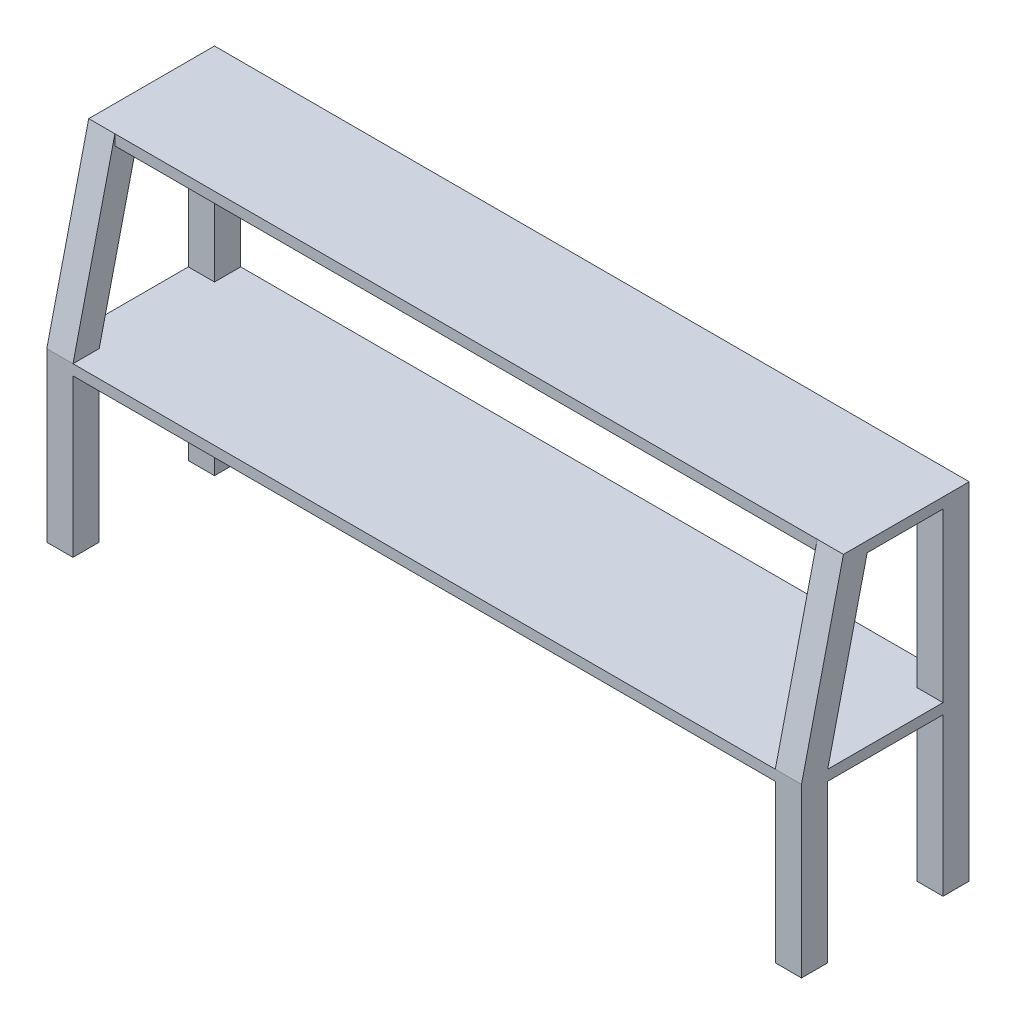
from build123d import *

# Parameters (mm, degrees)
SKETCH1_W           = 914.4
SKETCH1_H           = 203.2
BOSS_EXTRUDE1_DEPTH = 12.7
SKETCH2_W           = 914.4
SKETCH2_H           = 152.4
BOSS_EXTRUDE2_DEPTH = 12.7
SKETCH3_W           = 31.75
SKETCH3_H           = 419.1
BOSS_EXTRUDE3_DEPTH = 31.75
BOSS_EXTRUDE4_START = -914.4
SKETCH3_2_W         = 31.75
SKETCH3_2_H         = 419.1
BOSS_EXTRUDE4_DEPTH = 31.75


with BuildPart() as part:
    # Sketch1 → Boss-Extrude1 (new body)
    with BuildSketch(Plane(origin=(0, 0, 0), x_dir=(1, 0, 0), z_dir=(0, 1, 0))):
        with Locations((457.2, 101.6)):
            Rectangle(SKETCH1_W, SKETCH1_H)
    extrude(amount=BOSS_EXTRUDE1_DEPTH)



with BuildPart() as body_2:
    # Sketch2 → Boss-Extrude2 (new body)
    with BuildSketch(Plane(origin=(0, 215.9, 0), x_dir=(1, 0, 0), z_dir=(0, 1, 0))):
        with Locations((457.2, 127)):
            Rectangle(SKETCH2_W, SKETCH2_H)
    extrude(amount=BOSS_EXTRUDE2_DEPTH)


with BuildPart() as part_1:
    add(part.part)

    add(body_2.part)  # Boss-Extrude3 merges body 2
    # Sketch3 → Boss-Extrude3 (add)
    with BuildSketch(Plane(origin=(914.4, 0, 0), x_dir=(0, 0, -1), z_dir=(1, 0, 0))):
        with Locations((187.325, 19.05)):
            Rectangle(SKETCH3_W, SKETCH3_H)
        Polygon((0, 12.7), (0, -190.5), (31.75, -190.5), (31.75, 12.7), (82.55, 228.6), (50.8, 228.6), align=None)
    extrude(amount=-BOSS_EXTRUDE3_DEPTH)

    # Sketch3<2> → Boss-Extrude4 (add)
    with BuildSketch(Plane(origin=(914.4, 0, 0), x_dir=(0, 0, -1), z_dir=(1, 0, 0)).offset(BOSS_EXTRUDE4_START)):
        with Locations((187.325, 19.05)):
            Rectangle(SKETCH3_2_W, SKETCH3_2_H)
        Polygon((0, 12.7), (0, -190.5), (31.75, -190.5), (31.75, 12.7), (82.55, 228.6), (50.8, 228.6), align=None)
    extrude(amount=BOSS_EXTRUDE4_DEPTH)


solid = part_1.part
